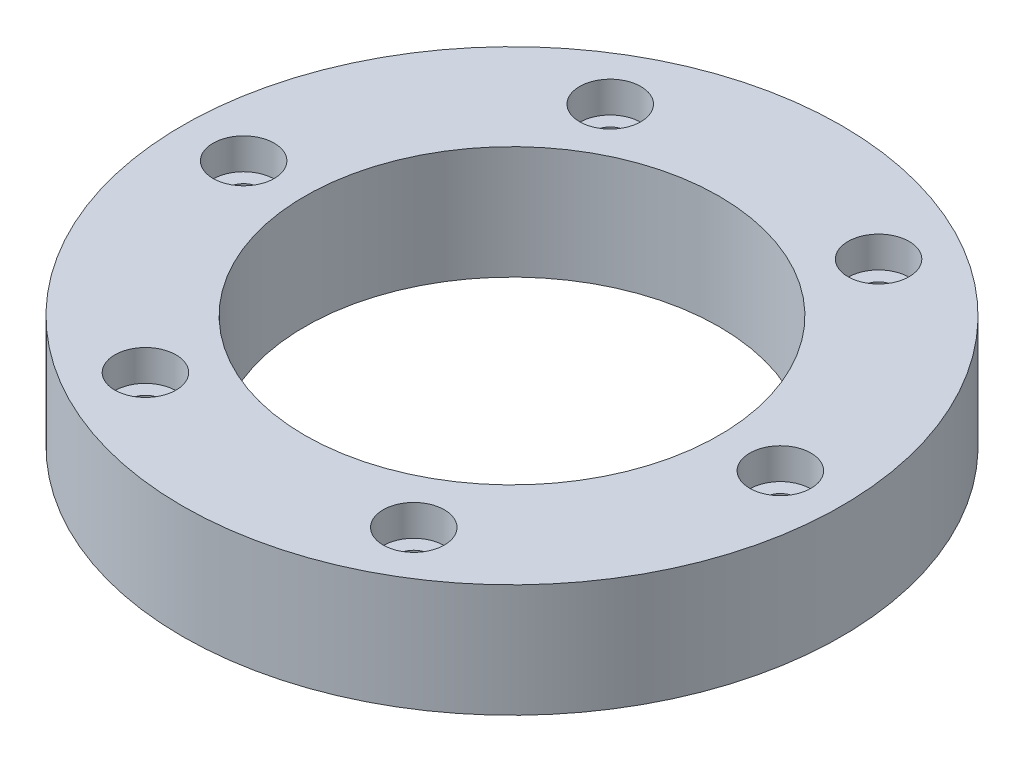
from build123d import *

# Parameters (mm, degrees)
SKETCH_1_R          = 35
SKETCH_1_R_2        = 1.7
SKETCH_1_R_3        = 22
EXTRUDE_1_DEPTH     = 12
SKETCH_2_R          = 3.25
CUT_EXTRUDE_1_DEPTH = 3.3


with BuildPart() as part:
    # 草图1 → 凸台-拉伸1 (new body)
    with BuildSketch(Plane(origin=(0, 0, 0), x_dir=(1, 0, 0), z_dir=(0, 1, 0))):
        with Locations(Location((0, 0, 0), (0, 0, 270))):
            Circle(SKETCH_1_R)
        with Locations(Location((-28.5, 0, 0), (0, 0, 270))):
            Circle(SKETCH_1_R_2, mode=Mode.SUBTRACT)
        with Locations(Location((-14.25, 24.681724008, 0), (0, 0, 270))):
            Circle(SKETCH_1_R_2, mode=Mode.SUBTRACT)
        with Locations(Location((14.25, 24.681724008, 0), (0, 0, 270))):
            Circle(SKETCH_1_R_2, mode=Mode.SUBTRACT)
        with Locations(Location((28.5, 0, 0), (0, 0, 270))):
            Circle(SKETCH_1_R_2, mode=Mode.SUBTRACT)
        with Locations(Location((14.25, -24.681724008, 0), (0, 0, 270))):
            Circle(SKETCH_1_R_2, mode=Mode.SUBTRACT)
        with Locations(Location((-14.25, -24.681724008, 0), (0, 0, 270))):
            Circle(SKETCH_1_R_2, mode=Mode.SUBTRACT)
        with Locations(Location((0, 0, 0), (0, 0, 270))):
            Circle(SKETCH_1_R_3, mode=Mode.SUBTRACT)
    extrude(amount=EXTRUDE_1_DEPTH)

    # 草图2 → 切除-拉伸1 (cut)
    with BuildSketch(Plane(origin=(0, 12, 0), x_dir=(1, 0, 0), z_dir=(0, 1, 0))):
        with Locations(Location((-28.5, 0, 0), (0, 0, 270))):
            Circle(SKETCH_2_R)
        with Locations(Location((-14.25, 24.681724008, 0), (0, 0, 270))):
            Circle(SKETCH_2_R)
        with Locations(Location((14.25, 24.681724008, 0), (0, 0, 270))):
            Circle(SKETCH_2_R)
        with Locations(Location((28.5, 0, 0), (0, 0, 270))):
            Circle(SKETCH_2_R)
        with Locations(Location((14.25, -24.681724008, 0), (0, 0, 270))):
            Circle(SKETCH_2_R)
        with Locations(Location((-14.25, -24.681724008, 0), (0, 0, 270))):
            Circle(SKETCH_2_R)
    extrude(amount=-CUT_EXTRUDE_1_DEPTH, mode=Mode.SUBTRACT)


solid = part.part
